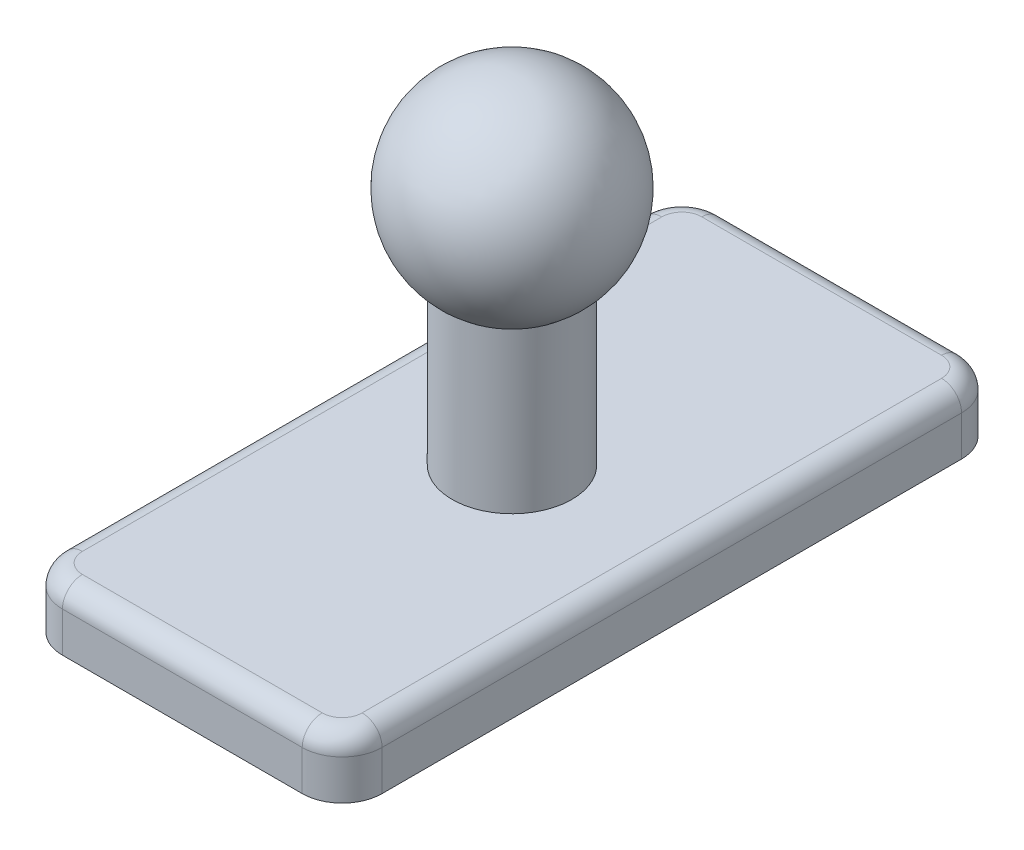
from build123d import *
from build123d.topology import SkipClean

# Parameters (mm, degrees)
BOSS_EXTRUDE1_DEPTH = 3
FILLET1_R           = 1
SKETCH2_R           = 3
BOSS_EXTRUDE2_DEPTH = 12


with BuildPart() as part:
    # Sketch1 → Boss-Extrude1 (new body)
    with BuildSketch(Plane(origin=(0, 0, 0), x_dir=(1, 0, 0), z_dir=(0, 1, 0))):
        with BuildLine():
            Line((-13.284983977, -5.078381136), (-1.284983977, -5.078381136))
            ThreePointArc((-1.284983977, -5.078381136), (0.129229585, -5.664167574), (0.715016023, -7.078381136))
            Line((0.715016023, -7.078381136), (0.715016023, -36.078381136))
            ThreePointArc((0.715016023, -36.078381136), (0.129229585, -37.492594699), (-1.284983977, -38.078381136))
            Line((-1.284983977, -38.078381136), (-13.284983977, -38.078381136))
            ThreePointArc((-13.284983977, -38.078381136), (-14.69919754, -37.492594699), (-15.284983977, -36.078381136))
            Line((-15.284983977, -36.078381136), (-15.284983977, -7.078381136))
            ThreePointArc((-15.284983977, -7.078381136), (-14.69919754, -5.664167574), (-13.284983977, -5.078381136))
        make_face()
    extrude(amount=BOSS_EXTRUDE1_DEPTH)

    # Fillet1
    fillet1_edges = [part.edges().sort_by_distance(p)[0] for p in [
        (-14.69919754, 3, 5.664167574),
        (-15.284983977, 3, 21.578381136),
        (-14.69919754, 3, 37.492594699),
        (-7.284983977, 3, 38.078381136),
        (0.129229585, 3, 37.492594699),
        (0.715016023, 3, 21.578381136),
        (0.129229585, 3, 5.664167574),
        (-7.284983977, 3, 5.078381136),
    ]]
    fillet(fillet1_edges, radius=FILLET1_R)

    # Sketch2 → Boss-Extrude2 (add)
    with BuildSketch(Plane(origin=(0, 3, 0), x_dir=(1, 0, 0), z_dir=(0, 1, 0))):
        with Locations(Location((-7.284983977, -21.578381136, 0), (0, 0, 90))):
            Circle(SKETCH2_R)
    extrude(amount=BOSS_EXTRUDE2_DEPTH)

    # Sketch3 → Revolve9 (revolve)
    with SkipClean():  # the faces are left unmerged after this step: merging them gives an invalid solid
        with BuildSketch(Plane(origin=(0, 15, 0), x_dir=(1, 0, 0), z_dir=(0, 1, 0))):
            with BuildLine():
                ThreePointArc((-2.284983977, -21.578381136), (-3.749450071, -18.04284723), (-7.284983977, -16.578381136))
                Line((-7.284983977, -16.578381136), (-7.284983977, -18.578381136))
                ThreePointArc((-7.284983977, -18.578381136), (-5.163663634, -19.457060793), (-4.284983977, -21.578381136))
                ThreePointArc((-4.284983977, -21.578381136), (-5.163663634, -23.69970148), (-7.284983977, -24.578381136))
                Line((-7.284983977, -24.578381136), (-7.284983977, -26.578381136))
                ThreePointArc((-7.284983977, -26.578381136), (-3.749450071, -25.113915042), (-2.284983977, -21.578381136))
            make_face()
            with BuildLine():
                Line((-7.284983977, -18.578381136), (-7.284983977, -16.578381136))
                ThreePointArc((-7.284983977, -16.578381136), (-12.284983977, -21.578381136), (-7.284983977, -26.578381136))
                Line((-7.284983977, -26.578381136), (-7.284983977, -24.578381136))
                ThreePointArc((-7.284983977, -24.578381136), (-10.284983977, -21.578381136), (-7.284983977, -18.578381136))
            make_face()
        revolve(axis=Axis((-7.284983977, 15, 12.733179874), (0, 0, 1)))


solid = part.part
